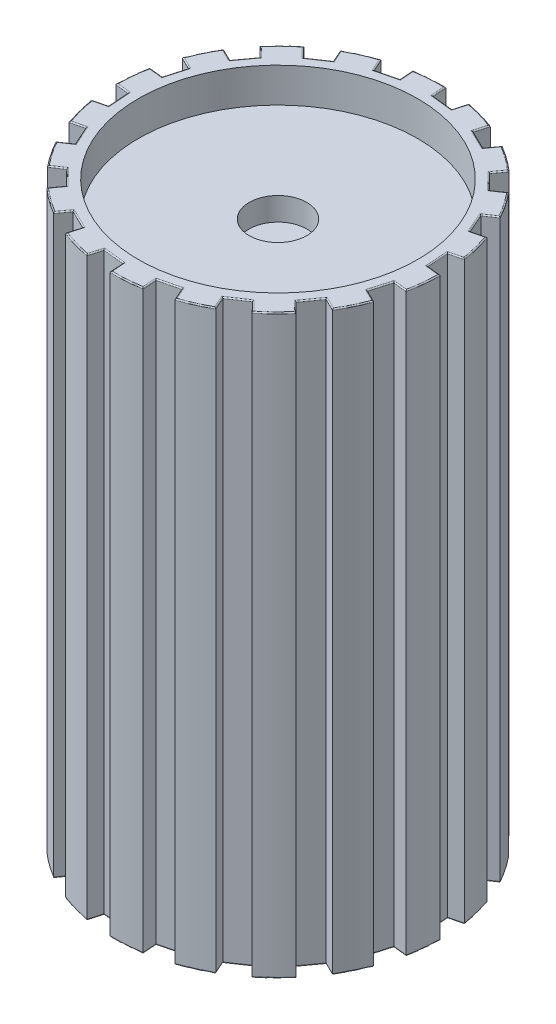
from build123d import *

# Parameters (mm, degrees)
SKETCH_1_R          = 13
EXTRUDE_1_DEPTH     = 50
SKETCH_6_R          = 14.2
EXTRUDE_4_DEPTH     = 50
SKETCH_2_R          = 12
CUT_EXTRUDE_1_DEPTH = 3
CUT_EXTRUDE_2_DEPTH = 54.88209350053132
SKETCH_8_R          = 2.5
CUT_EXTRUDE_3_DEPTH = 2
FILLET_6_R          = 0.1
FILLET_7_R          = 0.1
SKETCH_9_R          = 12.100000000000001
CUT_EXTRUDE_4_DEPTH = 52.11026088055363


with BuildPart() as part:
    # 草图1 → 凸台-拉伸1 (new body)
    with BuildSketch(Plane(origin=(0, 0, 0), x_dir=(1, 0, 0), z_dir=(0, 1, 0))):
        with Locations(Location((0, 0, 0), (0, 0, 270))):
            Circle(SKETCH_1_R)
    extrude(amount=EXTRUDE_1_DEPTH)

    # 草图6 → 凸台-拉伸4 (add, through all)
    with BuildSketch(Plane(origin=(0, 50, 0), x_dir=(1, 0, 0), z_dir=(0, 1, 0))):
        with Locations(Location((0, 0, 0), (0, 0, 270))):
            Circle(SKETCH_6_R)
    extrude(amount=-EXTRUDE_4_DEPTH)

    # 草图2 → 切除-拉伸1 (cut)
    with BuildSketch(Plane(origin=(0, 50, 0), x_dir=(1, 0, 0), z_dir=(0, 1, 0))):
        with Locations(Location((0, 0, 0), (0, 0, 270))):
            Circle(SKETCH_2_R)
    extrude(amount=-CUT_EXTRUDE_1_DEPTH, mode=Mode.SUBTRACT)

    # 草图7 → 切除-拉伸2 (cut, through all)
    with BuildSketch(Plane(origin=(0, 50, 0), x_dir=(1, 0, 0), z_dir=(0, 1, 0))):
        Polygon((-14.205956628538416, 5.438649780687507), (-12.209247123252698, 4.464782714012609), (-12.719988446062114, 2.683634463194698), (-14.929363787756492, 2.9158552881979722), align=None)
        Polygon((-15.209360392531067, 0.25193574377999506), (-12.999985050836699, 0.01971491877672277), (-12.870736322982134, -1.8287007694722146), (-15.02629422796951, -2.3661354448503324), align=None)
        Polygon((-14.378290826930783, -4.965165462002948), (-12.22273292194341, -4.427730786624833), (-11.469083447512197, -6.120467700591789), (-13.31083181980456, -7.362735322809633), align=None)
        Polygon((-11.81298718663035, -9.583394435030295), (-9.97123881433799, -8.34112681281245), (-8.684089842628175, -9.674015898536833), (-9.989886647215982, -11.471280658437447), align=None)
        Polygon((-7.822862950499235, -13.045724603354365), (-6.517066145911433, -11.248459843453752), (-4.851666839206877, -12.060735005849352), (-5.464013709948474, -14.19622024858584), align=None)
        Polygon((-2.889185989376832, -14.934547850124138), (-2.276839118635237, -12.799062607387654), (-0.43406121200057385, -12.99275147396491), (-0.2791000790072107, -15.20888616285766), align=None)
        Polygon((2.3929694419083845, -15.022044215716942), (2.2380083089150213, -12.805909526824196), (4.035898603434258, -12.35765036173067), (4.939477140540828, -14.387135946634562), align=None)
        Polygon((7.386497442031838, -13.297660347133453), (6.482918904925269, -11.268174762229567), (8.019069483775265, -10.232034236376228), (9.562280518021044, -11.830084803734598), align=None)
        Polygon((11.489104837554269, -9.96938238812033), (9.945893803308492, -8.37133182076196), (11.035022235511942, -6.872283773372262), (13.03173174079767, -7.846150840047165), align=None)
        Polygon((14.205956628539056, -5.4386497806857825), (12.209247123253332, -4.464782714010882), (12.719988446062752, -2.6836344631929734), (14.92936378775713, -2.9158552881962487), align=None)
        Polygon((15.209360392531396, -0.2519357437782243), (12.999985050837022, -0.01971491877495044), (12.870736322982461, 1.8287007694739865), (15.026294227969839, 2.3661354448521017), align=None)
        Polygon((14.378290826931421, 4.9651654620046735), (12.222732921944047, 4.42773078662656), (11.469083447512835, 6.120467700593514), (13.310831819805198, 7.362735322811359), align=None)
        Polygon((11.812987186630993, 9.583394435032018), (9.971238814338632, 8.341126812814172), (8.684089842628818, 9.674015898538556), (9.989886647216624, 11.471280658439172), align=None)
        Polygon((7.822862950499873, 13.045724603356094), (6.51706614591207, 11.248459843455478), (4.851666839207514, 12.060735005851077), (5.464013709949111, 14.196220248587567), align=None)
        Polygon((2.889185989377476, 14.934547850125863), (2.27683911863588, 12.799062607389379), (0.434061212001217, 12.992751473966637), (0.2791000790078543, 15.208886162859384), align=None)
        Polygon((-2.392969441907751, 15.022044215718667), (-2.2380083089143876, 12.805909526825921), (-4.0358986034336235, 12.357650361732393), (-4.939477140540196, 14.387135946636285), align=None)
        Polygon((-7.386497442031198, 13.297660347135182), (-6.482918904924627, 11.268174762231292), (-8.019069483774626, 10.232034236377954), (-9.562280518020403, 11.830084803736327), align=None)
        Polygon((-11.489104837553624, 9.969382388122062), (-9.945893803307687, 8.371331820763402), (-11.035022235511299, 6.8722837733739945), (-13.031731740797024, 7.846150840048898), align=None)
    extrude(amount=-CUT_EXTRUDE_2_DEPTH, mode=Mode.SUBTRACT)

    # 草图8 → 切除-拉伸3 (cut)
    with BuildSketch(Plane(origin=(0, 47, 0), x_dir=(1, 0, 0), z_dir=(0, 1, 0))):
        with Locations(Location((0, 0, 0), (0, 0, 270))):
            Circle(SKETCH_8_R)
    extrude(amount=-CUT_EXTRUDE_3_DEPTH, mode=Mode.SUBTRACT)

    # 圆角6
    fillet_6_edges = [part.edges().sort_by_distance(p)[0] for p in [
        (-6.728153766303459, 0, -11.818985340001293),
        (-7.2509941943496266, 0, -10.750104499304623),
        (-8.437903186125949, -7.11e-15, -10.665751609321998),
        (-2.2800653857573336, 0, -13.407377424644348),
        (-3.136953456174006, -7.11e-15, -12.581779944279157),
        (-4.2811334648124, -7.11e-15, -12.90846093950227),
        (2.4430325304923706, 0, -13.3786419200586),
        (1.3554501653185487, -7.11e-15, -12.89590704067801),
        (0.3920041351582791, 0, -13.594219371784956),
        (6.871464668244567, 0, -11.736244752187975),
        (5.684366492559793, -7.11e-15, -11.654597424653279),
        (5.017860251063981, 0, -12.640314318520218),
        (10.471096754988743, 0, -8.678283258678293),
        (9.327664328483726, 0, -9.007571355676365),
        (9.038488364961285, -7.11e-15, -10.161800807271012),
        (12.807760036151915, 0, -4.573592726351878),
        (11.84590818472844, 0, -5.274099243610037),
        (11.968941388162925, 0, -6.457624146457622),
        (13.599618434548585, 0, 0.08274058781234206),
        (12.935360686909743, 0, -0.9044929253495182),
        (13.455763437190328, 0, -1.9745627091993043),
        (12.75116214074675, 0, 4.729094165965368),
        (12.464617784658044, 0, 3.5742085886019277),
        (13.319621829774324, -7.11e-15, 2.7466601322303665),
        (10.364727505660142, 0, 8.805049193706342),
        (10.490458019410218, 0, 7.621807797067111),
        (11.576937253005369, 0, 7.136595225326753),
        (6.728153766304343, -7.11e-15, 11.818985340000113),
        (7.250994194350268, 0, 10.750104499302898),
        (8.43790318612692, -7.11e-15, 10.665751609320616),
        (2.2800653857580233, 0, 13.407377424643425),
        (3.13695345617464, 0, 12.581779944277434),
        (4.281133464813326, 0, 12.908460939501204),
        (-2.443032530491978, 0, 13.378641920057749),
        (-1.3554501653179054, -7.11e-15, 12.895907040676283),
        (-0.3920041351575749, 0, 13.5942193717841),
        (-6.871464668244464, 0, 11.736244752186984),
        (-5.684366492559156, -7.11e-15, 11.654597424651554),
        (-5.017860251063599, 0, 12.640314318519382),
        (-10.471096754988764, -7.11e-15, 8.678283258677016),
        (-9.327664328483083, -7.11e-15, 9.007571355674642),
        (-9.03848836496115, -7.11e-15, 10.161800807269987),
        (-12.807760036151851, 0, 4.573592726350294),
        (-11.845908184727804, 0, 5.274099243608312),
        (-11.968941388162865, 0, 6.4576241464562845),
        (-13.599618434548411, 0, -0.08274058781413007),
        (-12.935360686909418, 0, 0.904492925347746),
        (-13.455763437190289, -7.11e-15, 1.9745627091976043),
        (-10.364727505659209, -7.11e-15, -8.805049193707685),
        (-10.490458019409493, -7.11e-15, -7.621807797068699),
        (-11.576937253004566, 0, -7.136595225328407),
        (-12.751162140746109, 0, -4.729094165967091),
        (-12.464617784657408, 0, -3.5742085886036534),
        (-13.31962182977383, 0, -2.7466601322321056),
        (5.775624794775958, 0, 12.972361320514056),
        (9.864120878193807, 0, 10.214652186950909),
        (12.762858404781777, 0, 6.224905247430767),
        (14.122206848023824, 0, 1.4843428652535127),
        (13.77820872381868, 0, -3.4352531730407825),
        (11.772355282817205, 0, -7.940506979729056),
        (8.346582053248161, 0, -11.488018455260057),
        (3.9140878456257306, 0, -13.649905359991509),
        (-0.9905031219634892, 0, -14.165412227160232),
        (-5.775624794774776, 0, -12.972361320514581),
        (-9.864120878192615, 0, -10.21465218695206),
        (-12.762858404780967, 0, -6.22490524743243),
        (-14.122206848023636, 0, -1.4843428652552988),
        (-13.778208723819066, 0, 3.435253173039236),
        (-11.772355282817802, 0, 7.94050697972817),
        (-8.34658205324856, 0, 11.488018455259766),
        (-3.914087845625599, 0, 13.649905359991548),
        (0.9905031219642529, 0, 14.165412227160179),
    ]]
    fillet(fillet_6_edges, radius=FILLET_6_R)

    # 圆角7
    fillet_7_edges = [part.edges().sort_by_distance(p)[0] for p in [
        (-7.2509941943496266, 50, -10.750104499304623),
        (-6.728153766303471, 50, -11.818985340001321),
        (-3.1369534561740053, 50, -12.581779944279157),
        (-2.2800653857573345, 50, -13.40737742464436),
        (3.67e-15, 50, -12),
        (1.3554501653185484, 50, -12.895907040678008),
        (2.443032530492374, 50, -13.378641920058612),
        (5.684366492559792, 50, -11.654597424653279),
        (6.871464668244587, 50, -11.736244752188004),
        (9.327664328483724, 50, -9.007571355676365),
        (10.471096754988713, 50, -8.678283258678274),
        (11.84590818472844, 50, -5.274099243610037),
        (12.807760036151942, 50, -4.573592726351884),
        (5.775624794775687, 50, 12.972361320514176),
        (12.935360686909743, 50, -0.904492925349518),
        (13.599618434548539, 50, 0.08274058781233734),
        (9.864120878193688, 50, 10.214652186951023),
        (12.762858404781761, 50, 6.224905247430801),
        (12.464617784658042, 50, 3.5742085886019277),
        (12.75116214074674, 50, 4.729094165965362),
        (14.122206848023845, 50, 1.4843428652532995),
        (10.490458019410216, 50, 7.6218077970671105),
        (10.364727505660165, 50, 8.805049193706365),
        (13.77820872381868, 50, -3.43525317304078),
        (11.772355282817156, 50, -7.940506979729128),
        (7.250994194350267, 50, 10.750104499302896),
        (6.728153766304356, 50, 11.818985340000141),
        (8.346582053248392, 50, -11.488018455259889),
        (3.1369534561746395, 50, 12.581779944277432),
        (2.2800653857580238, 50, 13.407377424643437),
        (3.9140878456257977, 50, -13.649905359991491),
        (-0.990503121963571, 50, -14.165412227160225),
        (-1.3554501653179054, 50, 12.895907040676281),
        (-2.443032530491982, 50, 13.378641920057763),
        (-5.775624794774511, 50, -12.9723613205147),
        (-5.684366492559155, 50, 11.654597424651552),
        (-6.871464668244485, 50, 11.736244752187012),
        (-9.864120878192502, 50, -10.21465218695217),
        (-12.76285840478095, 50, -6.2249052474324635),
        (-9.327664328483083, 50, 9.007571355674642),
        (-10.471096754988734, 50, 8.678283258676997),
        (-14.122206848023657, 50, -1.4843428652550854),
        (-11.845908184727804, 50, 5.274099243608311),
        (-12.807760036151876, 50, 4.5735927263503005),
        (-13.778208723819066, 50, 3.435253173039236),
        (-11.77235528281776, 50, 7.940506979728233),
        (-12.935360686909416, 50, 0.9044929253477458),
        (-13.599618434548368, 50, -0.08274058781412547),
        (-8.346582053248795, 50, 11.488018455259596),
        (-3.9140878456256596, 50, 13.64990535999153),
        (-10.490458019409493, 50, -7.621807797068698),
        (-10.364727505659229, 50, -8.805049193707706),
        (0.9905031219643332, 50, 14.165412227160173),
        (-13.319621829773826, 50, -2.746660132232105),
        (-12.464617784657406, 50, -3.5742085886036534),
        (-12.7511621407461, 50, -4.729094165967087),
        (-11.576937253004552, 50, -7.1365952253284),
        (-13.455763437190313, 50, 1.9745627091976108),
        (-11.96894138816285, 50, 6.457624146456274),
        (-9.03848836496114, 50, 10.161800807269973),
        (-5.0178602510636, 50, 12.640314318519383),
        (-0.3920041351575728, 50, 13.59421937178413),
        (4.281133464813316, 50, 12.908460939501182),
        (8.43790318612692, 50, 10.665751609320616),
        (11.576937253005354, 50, 7.136595225326745),
        (13.319621829774322, 50, 2.746660132230366),
        (13.455763437190354, 50, -1.9745627091993105),
        (11.96894138816291, 50, -6.4576241464576105),
        (9.038488364961276, 50, -10.161800807270998),
        (5.017860251063982, 50, -12.640314318520218),
        (0.3920041351582771, 50, -13.594219371784982),
        (-4.281133464812391, 50, -12.908460939502248),
        (-8.437903186125949, 50, -10.665751609321998),
    ]]
    fillet(fillet_7_edges, radius=FILLET_7_R)

    # 草图9 → 切除-拉伸4 (cut, through all)
    with BuildSketch(Plane(origin=(0, 47, 0), x_dir=(1, 0, 0), z_dir=(0, 1, 0))):
        with Locations(Location((0, 0, 0), (0, 0, 90))):
            Circle(SKETCH_9_R)
    extrude(amount=CUT_EXTRUDE_4_DEPTH, mode=Mode.SUBTRACT)


solid = part.part
